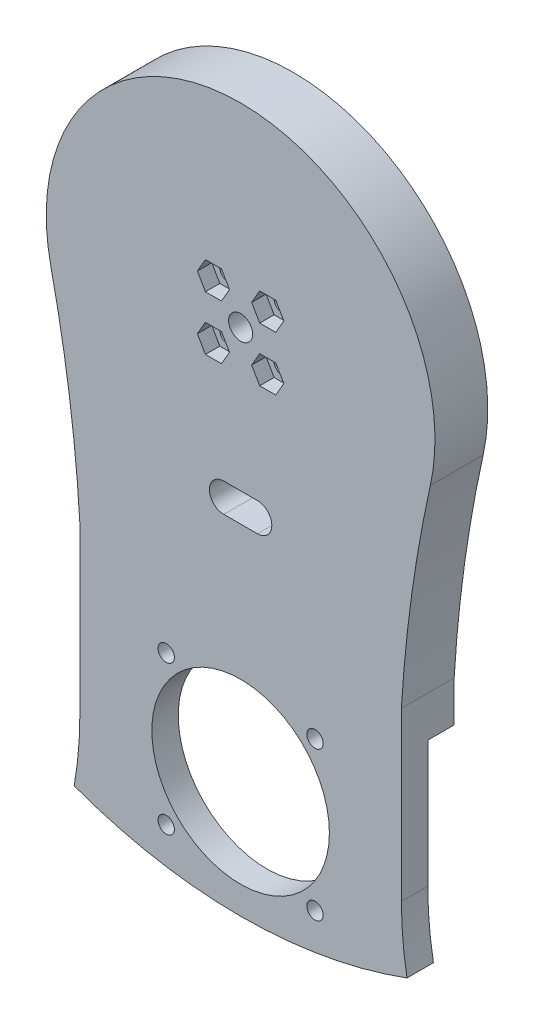
from build123d import *

# Parameters (mm, degrees)
SKETCH1_W           = 43
SKETCH1_H           = 43
SKETCH1_R           = 18.5
BOSS_EXTRUDE1_DEPTH = 5.5
SKETCH2_R           = 1.7
SKETCH2_R_2         = 2.5
BOSS_EXTRUDE2_DEPTH = 11
SKETCH3_R           = 1.7
CUT_EXTRUDE1_DEPTH  = 134.376282332
CUT_EXTRUDE11_DEPTH = 10
CUT_EXTRUDE12_DEPTH = 3
CUT_EXTRUDE13_DEPTH = 130.489381804


with BuildPart() as part:
    # Sketch1 → Boss-Extrude1 (new body)
    # profile 1 of 10: a face of its own
    with BuildSketch(Plane.XY):
        with BuildLine():
            Line((-33.5, -30), (-33.5, -4.850925931))
            ThreePointArc((-33.5, -4.850925931), (-34.593523061, -17.611516296), (-37.84220444, -30))
            Line((-37.84220444, -30), (-33.5, -30))
        make_face()
    # profile 2 of 10: a face of its own
    with BuildSketch(Plane.XY):
        Polygon((-21.5, -21.5), (-21.5, 21.5), (-33.5, 21.5), (-33.5, -4.850925931), (-33.5, -30), (0, -30), (33.5, -30), (33.5, -4.850925931), (33.5, 21.5), (21.5, 21.5), (21.5, -21.5), align=None)
    # profile 3 of 10: a face of its own
    with BuildSketch(Plane.XY):
        with BuildLine():
            ThreePointArc((37.84220444, -30), (34.593523061, -17.611516296), (33.5, -4.850925931))
            Line((33.5, -4.850925931), (33.5, -30))
            Line((33.5, -30), (37.84220444, -30))
        make_face()
    # profile 4 of 10: a face of its own
    with BuildSketch(Plane.XY):
        Rectangle(SKETCH1_W, SKETCH1_H)
        Circle(SKETCH1_R, mode=Mode.SUBTRACT)
    # profile 5 of 10: a face of its own
    with BuildSketch(Plane.XY):
        with BuildLine():
            Line((38.394173914, -31.5), (33.5, -31.5))
            Line((33.5, -31.5), (14.203872711, -31.5))
            ThreePointArc((14.203872711, -31.5), (34.722076366, -39.533108404), (51.594405594, -53.705335408))
            ThreePointArc((51.594405594, -53.705335408), (44.031058144, -43.175272448), (38.394173914, -31.5))
        make_face()
    # profile 6 of 10: a face of its own
    with BuildSketch(Plane.XY):
        with BuildLine():
            Line((-14.203872711, -31.5), (-33.5, -31.5))
            Line((-33.5, -31.5), (-38.394173914, -31.5))
            ThreePointArc((-38.394173914, -31.5), (-44.031058144, -43.175272448), (-51.594405594, -53.705335408))
            ThreePointArc((-51.594405594, -53.705335408), (-34.722076366, -39.533108404), (-14.203872711, -31.5))
        make_face()
    # profile 7 of 10: a face of its own
    with BuildSketch(Plane.XY):
        with BuildLine():
            Line((0, -30), (-33.5, -30))
            Line((-33.5, -30), (-33.5, -31.5))
            Line((-33.5, -31.5), (-14.203872711, -31.5))
            ThreePointArc((-14.203872711, -31.5), (-7.141428429, -30.376039749), (0, -30))
        make_face()
    # profile 8 of 10: a face of its own
    with BuildSketch(Plane.XY):
        with BuildLine():
            Line((33.5, -31.5), (33.5, -30))
            Line((33.5, -30), (0, -30))
            ThreePointArc((0, -30), (7.141428429, -30.376039749), (14.203872711, -31.5))
            Line((14.203872711, -31.5), (33.5, -31.5))
        make_face()
    # profile 9 of 10: a face of its own
    with BuildSketch(Plane.XY):
        with BuildLine():
            Line((37.84220444, -30), (33.5, -30))
            Line((33.5, -30), (33.5, -31.5))
            Line((33.5, -31.5), (38.394173914, -31.5))
            ThreePointArc((38.394173914, -31.5), (38.114193229, -30.751470427), (37.84220444, -30))
        make_face()
    # profile 10 of 10: a face of its own
    with BuildSketch(Plane.XY):
        with BuildLine():
            Line((-33.5, -31.5), (-33.5, -30))
            Line((-33.5, -30), (-37.84220444, -30))
            ThreePointArc((-37.84220444, -30), (-38.114193229, -30.751470427), (-38.394173914, -31.5))
            Line((-38.394173914, -31.5), (-33.5, -31.5))
        make_face()
    extrude(amount=BOSS_EXTRUDE1_DEPTH)

    # Sketch2 → Boss-Extrude2 (add)
    with BuildSketch(Plane.XY.offset(5.5)):
        with BuildLine():
            Line((-33.5, 30), (-33.5, 21.5))
            Line((-33.5, 21.5), (33.5, 21.5))
            Line((33.5, 21.5), (33.5, 30))
            ThreePointArc((33.5, 30), (35.66625593, 51.742394188), (39.542569928, 73.245848783))
            ThreePointArc((39.542569928, 73.245848783), (0, 122.5), (-39.542569928, 73.245848783))
            ThreePointArc((-39.542569928, 73.245848783), (-35.66625593, 51.742394188), (-33.5, 30))
        make_face()
        with Locations((-5.656854249, 76.343145751)):
            Circle(SKETCH2_R, mode=Mode.SUBTRACT)
        with Locations((5.656854249, 76.343145751)):
            Circle(SKETCH2_R, mode=Mode.SUBTRACT)
        with Locations((0, 82)):
            Circle(SKETCH2_R_2, mode=Mode.SUBTRACT)
        with Locations((-5.656854249, 87.656854249)):
            Circle(SKETCH2_R, mode=Mode.SUBTRACT)
        with Locations((5.656854249, 87.656854249)):
            Circle(SKETCH2_R, mode=Mode.SUBTRACT)
    extrude(amount=-BOSS_EXTRUDE2_DEPTH)

    # Sketch3 → Cut-Extrude1 (cut, through all)
    with BuildSketch(Plane.XY.offset(5.5)):
        with Locations((-15.5, 15.5)):
            Circle(SKETCH3_R)
        with Locations((15.5, 15.5)):
            Circle(SKETCH3_R)
        with Locations((15.5, -15.5)):
            Circle(SKETCH3_R)
        with Locations((-15.5, -15.5)):
            Circle(SKETCH3_R)
    extrude(amount=-CUT_EXTRUDE1_DEPTH, mode=Mode.SUBTRACT)

    # Sketch4 → Cut-Extrude11 (cut)
    with BuildSketch(Plane(origin=(0, 0, 0), x_dir=(-1, 0, 0), z_dir=(0, 0, -1))):
        with BuildLine():
            ThreePointArc((33.5, -18.5), (0, -24.278187239), (-33.5, -18.5))
            ThreePointArc((-33.5, -18.5), (-34.088098429, -18.288833154), (-34.674865885, -18.073995652))
            ThreePointArc((-34.674865885, -18.073995652), (-40.75024769, -37.021892063), (-51.594405594, -53.705335408))
            ThreePointArc((-51.594405594, -53.705335408), (0, -30), (51.594405594, -53.705335408))
            ThreePointArc((51.594405594, -53.705335408), (40.75024769, -37.021892063), (34.674865885, -18.073995652))
            ThreePointArc((34.674865885, -18.073995652), (34.088098429, -18.288833154), (33.5, -18.5))
        make_face()
    extrude(amount=-CUT_EXTRUDE11_DEPTH, mode=Mode.SUBTRACT)

    # Sketch5 → Cut-Extrude12 (cut)
    with BuildSketch(Plane.XY.offset(5.5)):
        Polygon((-7.331854249, 90.558039352), (-3.981854249, 90.558039352), (-2.306854249, 87.656854249), (-3.981854249, 84.755669147), (-7.331854249, 84.755669147), (-9.006854249, 87.656854249), align=None)
        Polygon((3.981854249, 90.558039352), (7.331854249, 90.558039352), (9.006854249, 87.656854249), (7.331854249, 84.755669147), (3.981854249, 84.755669147), (2.306854249, 87.656854249), align=None)
        Polygon((-7.331854249, 79.244330853), (-9.006854249, 76.343145751), (-7.331854249, 73.441960648), (-3.981854249, 73.441960648), (-2.306854249, 76.343145751), (-3.981854249, 79.244330853), align=None)
        Polygon((3.981854249, 79.244330853), (7.331854249, 79.244330853), (9.006854249, 76.343145751), (7.331854249, 73.441960648), (3.981854249, 73.441960648), (2.306854249, 76.343145751), align=None)
    extrude(amount=-CUT_EXTRUDE12_DEPTH, mode=Mode.SUBTRACT)

    # Sketch6 → Cut-Extrude13 (cut, through all)
    with BuildSketch(Plane(origin=(0, 0, -5.5), x_dir=(-1, 0, 0), z_dir=(0, 0, -1))):
        with BuildLine():
            Line((3.5, 46.5), (-3.5, 46.5))
            ThreePointArc((-3.5, 46.5), (-6.5, 49.5), (-3.5, 52.5))
            Line((-3.5, 52.5), (3.5, 52.5))
            ThreePointArc((3.5, 52.5), (6.5, 49.5), (3.5, 46.5))
        make_face()
    extrude(amount=-CUT_EXTRUDE13_DEPTH, mode=Mode.SUBTRACT)


solid = part.part
